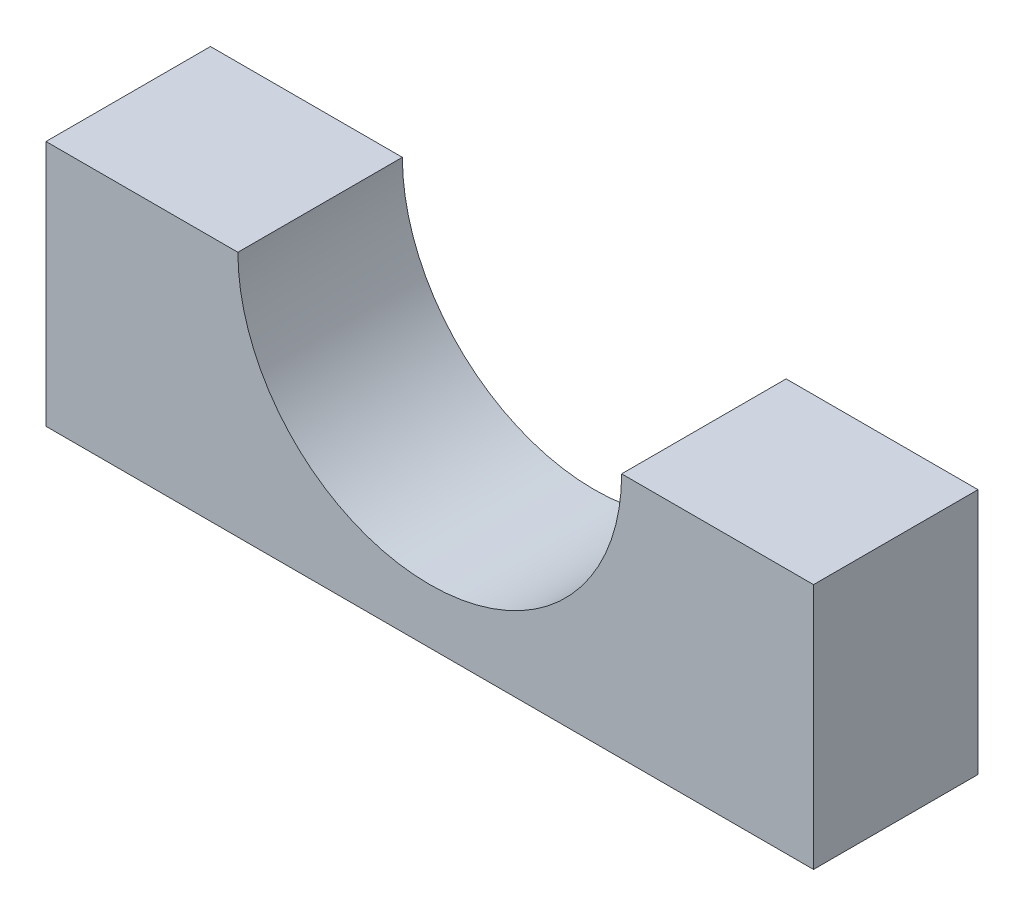
from build123d import *

# Parameters (mm, degrees)
BOSS_EXTRUDE1_DEPTH = 15
SKETCH5_R           = 5
BOSS_EXTRUDE4_DEPTH = 22.5


with BuildPart() as part:
    # profiil → Boss-Extrude1 (new body)
    with BuildSketch(Plane.XY):
        with BuildLine():
            Line((35, 22.5), (17.5, 22.5))
            ThreePointArc((17.5, 22.5), (0, 5), (-17.5, 22.5))
            Line((-17.5, 22.5), (-35, 22.5))
            Line((-35, 22.5), (-35, 0))
            Line((-35, 0), (35, 0))
            Line((35, 0), (35, 22.5))
        make_face()
    extrude(amount=BOSS_EXTRUDE1_DEPTH)

    # Sketch5 → Boss-Extrude4 (add, through all)
    with BuildSketch(Plane(origin=(0, 0, 0), x_dir=(1, 0, 0), z_dir=(0, 1, 0))):
        with Locations((-25, -7.5)):
            Circle(SKETCH5_R)
        with Locations((25, -7.5)):
            Circle(SKETCH5_R)
    extrude(amount=BOSS_EXTRUDE4_DEPTH)


solid = part.part
